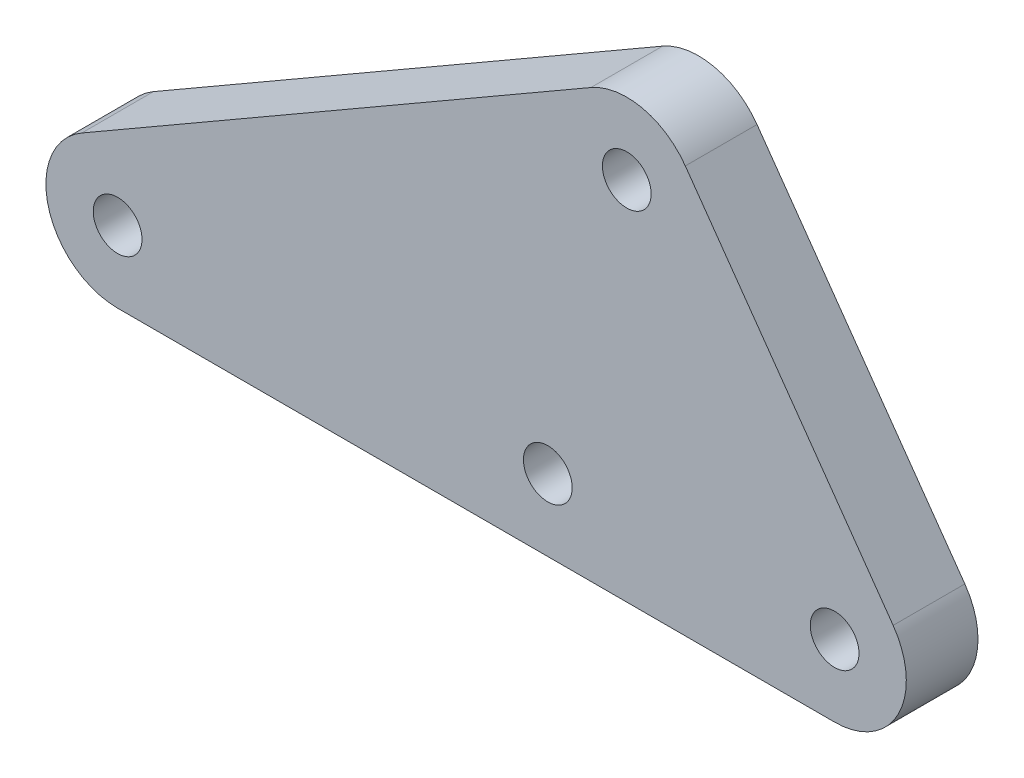
from build123d import *

# Parameters (mm, degrees)
SKETCH_1_R      = 1.7
EXTRUDE_1_DEPTH = 5


with BuildPart() as part:
    # ｽｹｯﾁ1 → ﾎﾞｽ - 押し出し1 (new body)
    with BuildSketch(Plane.XY):
        with BuildLine():
            Line((54.082739258, 2.886388773), (39.5897808, 23.386388791))
            ThreePointArc((39.5897808, 23.386388791), (36.578191054, 25.383916333), (33.007041847, 24.830127187))
            Line((33.007041847, 24.830127187), (-2.50000007, 4.330126978))
            ThreePointArc((-2.50000007, 4.330126978), (-4.829629126, -1.294095246), (-3.8e-08, -5))
            Line((-3.8e-08, -5), (50, -5))
            ThreePointArc((50, -5), (54.440267102, -2.298701387), (54.082739258, 2.886388773))
        make_face()
        Circle(SKETCH_1_R, mode=Mode.SUBTRACT)
        with Locations((30, 0)):
            Circle(SKETCH_1_R, mode=Mode.SUBTRACT)
        with Locations((35.507041555, 20.5)):
            Circle(SKETCH_1_R, mode=Mode.SUBTRACT)
        with Locations((50, 0)):
            Circle(SKETCH_1_R, mode=Mode.SUBTRACT)
    extrude(amount=EXTRUDE_1_DEPTH)


solid = part.part
